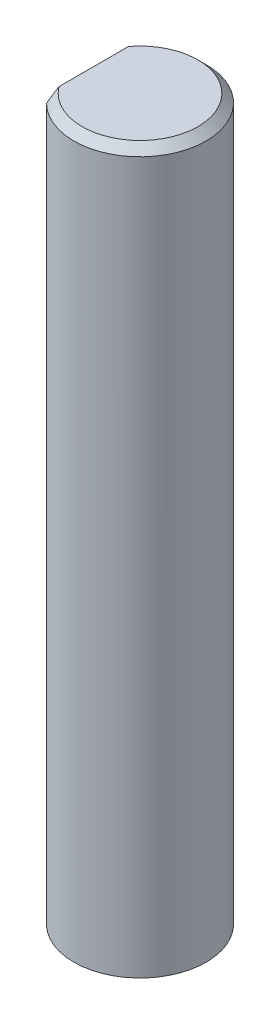
from build123d import *

# Parameters (mm, degrees)
SKETCH1_R           = 2
BOSS_EXTRUDE1_DEPTH = 21.75
CHAMFER1_SIZE       = 0.25
SKETCH2_OUTSIDE_W   = 10.494
SKETCH2_OUTSIDE_H   = 10.494
CUT_EXTRUDE1_DEPTH  = 12


with BuildPart() as part:
    # Sketch1 → Boss-Extrude1 (new body)
    with BuildSketch(Plane(origin=(0, 0, 0), x_dir=(1, 0, 0), z_dir=(0, 1, 0))):
        with Locations(Location((0, 0, 0), (0, 0, 270))):
            Circle(SKETCH1_R)
    extrude(amount=BOSS_EXTRUDE1_DEPTH)

    # Chamfer1
    chamfer1_edges = [part.edges().sort_by_distance(p)[0] for p in [
        (0, 21.75, -2),
    ]]
    chamfer(chamfer1_edges, length=CHAMFER1_SIZE)

    # Sketch2 outside → Cut-Extrude1 (cut)
    with BuildSketch(Plane(origin=(0, 21.75, 0), x_dir=(1, 0, 0), z_dir=(0, 1, 0))):
        Rectangle(SKETCH2_OUTSIDE_W, SKETCH2_OUTSIDE_H)
        with BuildLine():
            Line((-1.4, 1.428285686), (-1.4, -1.428285686))
            ThreePointArc((-1.4, -1.428285686), (2, 0), (-1.4, 1.428285686))
        make_face(mode=Mode.SUBTRACT)
    extrude(amount=-CUT_EXTRUDE1_DEPTH, mode=Mode.SUBTRACT)


solid = part.part
